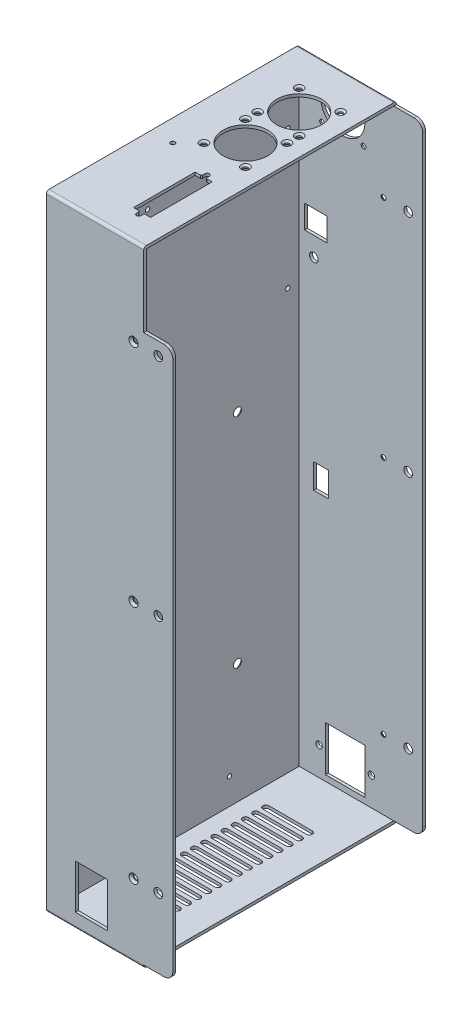
from build123d import *

# Parameters (mm, degrees)
SKETCH1_W                                         = 174
SKETCH1_H                                         = 430
BOSS_EXTRUDE1_DEPTH                               = 2
SKETCH2_W                                         = 174
SKETCH2_H                                         = 430
SKETCH2_W_2                                       = 170
SKETCH2_H_2                                       = 426
BOSS_EXTRUDE2_DEPTH                               = 65
SKETCH3_W                                         = 2
SKETCH3_H                                         = 377
SKETCH3_H_2                                       = 426
BOSS_EXTRUDE3_DEPTH                               = 20
FILLET1_R                                         = 1.8
SKETCH4_W                                         = 22.15
SKETCH4_H                                         = 30.5
CUT_EXTRUDE1_DEPTH                                = 5
SKETCH5_R                                         = 2.25
SKETCH5_R_2                                       = 3
SKETCH5_R_3                                       = 15.187
SKETCH5_R_4                                       = 1
SKETCH5_W                                         = 27.3
SKETCH5_H                                         = 31.1
SKETCH5_W_2                                       = 15.303
SKETCH5_H_2                                       = 16
SKETCH5_W_3                                       = 10
SKETCH5_H_3                                       = 17
CUT_EXTRUDE2_DEPTH                                = 5
SKETCH6_R                                         = 15.367
SKETCH6_R_2                                       = 1
SKETCH6_R_3                                       = 1.5
CUT_EXTRUDE3_DEPTH                                = 5
CSK_FOR_4_FLAT_HEAD_MACHINE_SCREW_100_D           = 3.2639
CSK_FOR_4_FLAT_HEAD_MACHINE_SCREW_100_DEPTH       = 10
CSK_FOR_4_FLAT_HEAD_MACHINE_SCREW_100_CSINK_D     = 5.715
CSK_FOR_4_FLAT_HEAD_MACHINE_SCREW_100_CSINK_ANGLE = 100
CSK_FOR_4_FLAT_HEAD_MACHINE_SCREW_100_TIP         = 0.980574487
CSK_FOR_4_FLAT_HEAD_MACHINE_SCREW_2_D             = 3.2639
CSK_FOR_4_FLAT_HEAD_MACHINE_SCREW_2_DEPTH         = 10
CSK_FOR_4_FLAT_HEAD_MACHINE_SCREW_2_CSINK_D       = 5.715
CSK_FOR_4_FLAT_HEAD_MACHINE_SCREW_2_CSINK_ANGLE   = 100
CSK_FOR_4_FLAT_HEAD_MACHINE_SCREW_2_TIP           = 0.980574487
SKETCH11_R                                        = 1.5
CUT_EXTRUDE4_DEPTH                                = 5
CSK_FOR_M4_FLAT_HEAD_MACHINE_SCREW1_D             = 4.5
CSK_FOR_M4_FLAT_HEAD_MACHINE_SCREW1_DEPTH         = 10
CSK_FOR_M4_FLAT_HEAD_MACHINE_SCREW1_CSINK_D       = 9.4
CSK_FOR_M4_FLAT_HEAD_MACHINE_SCREW1_CSINK_ANGLE   = 90
CSK_FOR_M4_FLAT_HEAD_MACHINE_SCREW1_TIP           = 1.351936393
SKETCH14_R                                        = 1.5
SKETCH14_R_2                                      = 3
CUT_EXTRUDE5_DEPTH                                = 290.948271249
CSK_FOR_M3_FLAT_HEAD_MACHINE_SCREW1_D             = 3.4
CSK_FOR_M3_FLAT_HEAD_MACHINE_SCREW1_DEPTH         = 10
CSK_FOR_M3_FLAT_HEAD_MACHINE_SCREW1_CSINK_D       = 6.3
CSK_FOR_M3_FLAT_HEAD_MACHINE_SCREW1_CSINK_ANGLE   = 90
CSK_FOR_M3_FLAT_HEAD_MACHINE_SCREW1_TIP           = 1.021463052
CSK_FOR_M3_FLAT_HEAD_MACHINE_SCREW2_D             = 3.4
CSK_FOR_M3_FLAT_HEAD_MACHINE_SCREW2_CSINK_D       = 6.3
CSK_FOR_M3_FLAT_HEAD_MACHINE_SCREW2_CSINK_ANGLE   = 90
CUT_EXTRUDE6_DEPTH                                = 10
FILLET2_R                                         = 6


with BuildPart() as part:
    # Sketch1 → Boss-Extrude1 (new body)
    with BuildSketch(Plane(origin=(0, 0, 0), x_dir=(0, 0, -1), z_dir=(1, 0, 0))):
        Rectangle(SKETCH1_W, SKETCH1_H)
    extrude(amount=BOSS_EXTRUDE1_DEPTH)

    # Sketch2 → Boss-Extrude2 (add)
    with BuildSketch(Plane(origin=(2, 0, 0), x_dir=(0, 0, -1), z_dir=(1, 0, 0))):
        Rectangle(SKETCH2_W, SKETCH2_H)
        Rectangle(SKETCH2_W_2, SKETCH2_H_2, mode=Mode.SUBTRACT)
    extrude(amount=BOSS_EXTRUDE2_DEPTH)

    # Sketch3 → Boss-Extrude3 (add)
    with BuildSketch(Plane(origin=(67, 0, 0), x_dir=(0, 0, -1), z_dir=(1, 0, 0))):
        with Locations((-86, -24.5)):
            Rectangle(SKETCH3_W, SKETCH3_H)
        with Locations((86, 0)):
            Rectangle(SKETCH3_W, SKETCH3_H_2)
    extrude(amount=BOSS_EXTRUDE3_DEPTH)

    # Fillet1
    fillet1_edges = [part.edges().sort_by_distance(p)[0] for p in [
        (33.5, -215, -87),
        (33.5, -215, 87),
        (33.5, 215, -87),
        (33.5, 215, 87),
    ]]
    fillet(fillet1_edges, radius=FILLET1_R)

    # Sketch4 → Cut-Extrude1 (cut)
    with BuildSketch(Plane.XY.offset(87)):
        with Locations((31.075, -189.75)):
            Rectangle(SKETCH4_W, SKETCH4_H)
    extrude(amount=-CUT_EXTRUDE1_DEPTH, mode=Mode.SUBTRACT)

    # Sketch5 → Cut-Extrude2 (cut)
    with BuildSketch(Plane(origin=(0, 0, -87), x_dir=(-1, 0, 0), z_dir=(0, 0, -1))):
        with Locations(Location((-51.65, -193.45, 0), (0, 0, 90))):
            Circle(SKETCH5_R)
        with Locations(Location((-15.65, -193.45, 0), (0, 0, 90))):
            Circle(SKETCH5_R)
        with Locations(Location((-12.096, 95.3, 0), (0, 0, 90))):
            Circle(SKETCH5_R_2)
        with Locations(Location((-32, 193, 0), (0, 0, 90))):
            Circle(SKETCH5_R_3)
        with Locations(Location((-46.2875, 207.2875, 0), (0, 0, 90))):
            Circle(SKETCH5_R_4)
        with Locations(Location((-17.7125, 207.2875, 0), (0, 0, 90))):
            Circle(SKETCH5_R_4)
        with Locations(Location((-46.2875, 178.7125, 0), (0, 0, 90))):
            Circle(SKETCH5_R_4)
        with Locations(Location((-17.7125, 178.7125, 0), (0, 0, 90))):
            Circle(SKETCH5_R_4)
        with Locations((-33.65, -193.45)):
            Rectangle(SKETCH5_W, SKETCH5_H)
        with Locations((-13.4295, 116.48)):
            Rectangle(SKETCH5_W_2, SKETCH5_H_2)
        with Locations((-17, -35)):
            Rectangle(SKETCH5_W_3, SKETCH5_H_3)
    extrude(amount=-CUT_EXTRUDE2_DEPTH, mode=Mode.SUBTRACT)

    # Sketch6 → Cut-Extrude3 (cut)
    with BuildSketch(Plane(origin=(0, 215, 0), x_dir=(1, 0, 0), z_dir=(0, 1, 0))):
        with Locations(Location((40, 47, 0), (0, 0, 270))):
            Circle(SKETCH6_R)
        with Locations(Location((40, 10, 0), (0, 0, 270))):
            Circle(SKETCH6_R)
        with Locations(Location((25.7125, 61.2875, 0), (0, 0, 270))):
            Circle(SKETCH6_R_2)
        with Locations(Location((25.7125, 32.7125, 0), (0, 0, 270))):
            Circle(SKETCH6_R_2)
        with Locations(Location((25.7125, 24.2875, 0), (0, 0, 270))):
            Circle(SKETCH6_R_2)
        with Locations(Location((25.7125, -4.2875, 0), (0, 0, 270))):
            Circle(SKETCH6_R_2)
        with Locations(Location((54.2875, -4.2875, 0), (0, 0, 270))):
            Circle(SKETCH6_R_2)
        with Locations(Location((54.2875, 24.2875, 0), (0, 0, 270))):
            Circle(SKETCH6_R_2)
        with Locations(Location((54.2875, 32.7125, 0), (0, 0, 270))):
            Circle(SKETCH6_R_2)
        with Locations(Location((54.2875, 61.2875, 0), (0, 0, 270))):
            Circle(SKETCH6_R_2)
        with Locations(Location((15, -15, 0), (0, 0, 270))):
            Circle(SKETCH6_R_3)
        with BuildLine():
            Line((40, -24.6), (43.528, -24.6))
            ThreePointArc((43.528, -24.6), (44.102877813, -24.361877813), (44.341, -23.787))
            Line((44.341, -23.787), (44.341, -22.3))
            ThreePointArc((44.341, -22.3), (45.865, -20.776), (47.389, -22.3))
            Line((47.389, -22.3), (47.389, -23.787))
            ThreePointArc((47.389, -23.787), (47.627122187, -24.361877813), (48.202, -24.6))
            Line((48.202, -24.6), (51.73, -24.6))
            Line((51.73, -24.6), (51.73, -67))
            Line((51.73, -67), (48.202, -67))
            ThreePointArc((48.202, -67), (47.627122187, -67.238122187), (47.389, -67.813))
            Line((47.389, -67.813), (47.389, -69.3))
            ThreePointArc((47.389, -69.3), (45.865, -70.824), (44.341, -69.3))
            Line((44.341, -69.3), (44.341, -67.813))
            ThreePointArc((44.341, -67.813), (44.102877813, -67.238122187), (43.528, -67))
            Line((43.528, -67), (40, -67))
            Line((40, -67), (40, -24.6))
        make_face()
    extrude(amount=-CUT_EXTRUDE3_DEPTH, mode=Mode.SUBTRACT)

    # CSK for _4 Flat Head Machine Screw _100
    with Locations(Plane(origin=(0, 215, 0), x_dir=(-1, 0, 0), z_dir=(0, 1, 0))):
        with Locations((-25.7125, 4.2875), (-25.7125, -61.2875), (-54.2875, -61.2875), (-54.2875, -32.7125), (-25.7125, -32.7125), (-25.7125, -24.2875), (-54.2875, -24.2875), (-54.2875, 4.2875)):
            CounterSinkHole(CSK_FOR_4_FLAT_HEAD_MACHINE_SCREW_100_D / 2, CSK_FOR_4_FLAT_HEAD_MACHINE_SCREW_100_CSINK_D / 2, depth=CSK_FOR_4_FLAT_HEAD_MACHINE_SCREW_100_DEPTH, counter_sink_angle=CSK_FOR_4_FLAT_HEAD_MACHINE_SCREW_100_CSINK_ANGLE)
            with Locations((0, 0, -(CSK_FOR_4_FLAT_HEAD_MACHINE_SCREW_100_DEPTH + CSK_FOR_4_FLAT_HEAD_MACHINE_SCREW_100_TIP / 2))):  # 118° drill point
                Cone(0, CSK_FOR_4_FLAT_HEAD_MACHINE_SCREW_100_D / 2, CSK_FOR_4_FLAT_HEAD_MACHINE_SCREW_100_TIP, mode=Mode.SUBTRACT)

    # CSK for _4 Flat Head Machine Screw _ 2
    with Locations(Plane(origin=(0, 0, -87), x_dir=(-1, 0, 0), z_dir=(0, 0, -1))):
        with Locations((-46.2875, 207.2875), (-17.7125, 207.2875), (-17.7125, 178.7125), (-46.2875, 178.7125)):
            CounterSinkHole(CSK_FOR_4_FLAT_HEAD_MACHINE_SCREW_2_D / 2, CSK_FOR_4_FLAT_HEAD_MACHINE_SCREW_2_CSINK_D / 2, depth=CSK_FOR_4_FLAT_HEAD_MACHINE_SCREW_2_DEPTH, counter_sink_angle=CSK_FOR_4_FLAT_HEAD_MACHINE_SCREW_2_CSINK_ANGLE)
            with Locations((0, 0, -(CSK_FOR_4_FLAT_HEAD_MACHINE_SCREW_2_DEPTH + CSK_FOR_4_FLAT_HEAD_MACHINE_SCREW_2_TIP / 2))):  # 118° drill point
                Cone(0, CSK_FOR_4_FLAT_HEAD_MACHINE_SCREW_2_D / 2, CSK_FOR_4_FLAT_HEAD_MACHINE_SCREW_2_TIP, mode=Mode.SUBTRACT)

    # Sketch11 → Cut-Extrude4 (cut)
    with BuildSketch(Plane(origin=(2, 0, 0), x_dir=(0, 0, -1), z_dir=(1, 0, 0))):
        with Locations((-19.33, 171.06)):
            Circle(SKETCH11_R)
        with Locations((77.19, 171.06)):
            Circle(SKETCH11_R)
        with Locations((-19.33, 75.81)):
            Circle(SKETCH11_R)
        with Locations((77.19, 75.81)):
            Circle(SKETCH11_R)
        with Locations((-7.5, 19.5)):
            Circle(SKETCH11_R)
        with Locations((42.5, 19.5)):
            Circle(SKETCH11_R)
        with Locations((42.5, -130.5)):
            Circle(SKETCH11_R)
        with Locations((-7.5, -130.5)):
            Circle(SKETCH11_R)
        with Locations((37, -195)):
            Circle(SKETCH11_R)
    extrude(amount=-CUT_EXTRUDE4_DEPTH, mode=Mode.SUBTRACT)

    # CSK for M4 Flat Head Machine Screw1
    with Locations(Plane.ZY):
        with Locations((-42.5, 19.5), (7.5, 19.5), (7.5, -130.5), (-42.5, -130.5)):
            CounterSinkHole(CSK_FOR_M4_FLAT_HEAD_MACHINE_SCREW1_D / 2, CSK_FOR_M4_FLAT_HEAD_MACHINE_SCREW1_CSINK_D / 2, depth=CSK_FOR_M4_FLAT_HEAD_MACHINE_SCREW1_DEPTH, counter_sink_angle=CSK_FOR_M4_FLAT_HEAD_MACHINE_SCREW1_CSINK_ANGLE)
            with Locations((0, 0, -(CSK_FOR_M4_FLAT_HEAD_MACHINE_SCREW1_DEPTH + CSK_FOR_M4_FLAT_HEAD_MACHINE_SCREW1_TIP / 2))):  # 118° drill point
                Cone(0, CSK_FOR_M4_FLAT_HEAD_MACHINE_SCREW1_D / 2, CSK_FOR_M4_FLAT_HEAD_MACHINE_SCREW1_TIP, mode=Mode.SUBTRACT)

    # Sketch14 → Cut-Extrude5 (cut, through all)
    with BuildSketch(Plane.XY.offset(87)):
        with Locations((60, 155)):
            Circle(SKETCH14_R)
        with Locations((60, 0)):
            Circle(SKETCH14_R)
        with Locations((60, -165)):
            Circle(SKETCH14_R)
        with Locations((77, 155)):
            Circle(SKETCH14_R_2)
        with Locations((77, 0)):
            Circle(SKETCH14_R_2)
        with Locations((77, -165)):
            Circle(SKETCH14_R_2)
    extrude(amount=-CUT_EXTRUDE5_DEPTH, mode=Mode.SUBTRACT)

    # CSK for M3 Flat Head Machine Screw1
    with Locations(Plane(origin=(0, 0, -87), x_dir=(-1, 0, 0), z_dir=(0, 0, -1))):
        with Locations((-60, 155), (-60, 0), (-60, -165)):
            CounterSinkHole(CSK_FOR_M3_FLAT_HEAD_MACHINE_SCREW1_D / 2, CSK_FOR_M3_FLAT_HEAD_MACHINE_SCREW1_CSINK_D / 2, depth=CSK_FOR_M3_FLAT_HEAD_MACHINE_SCREW1_DEPTH, counter_sink_angle=CSK_FOR_M3_FLAT_HEAD_MACHINE_SCREW1_CSINK_ANGLE)
            with Locations((0, 0, -(CSK_FOR_M3_FLAT_HEAD_MACHINE_SCREW1_DEPTH + CSK_FOR_M3_FLAT_HEAD_MACHINE_SCREW1_TIP / 2))):  # 118° drill point
                Cone(0, CSK_FOR_M3_FLAT_HEAD_MACHINE_SCREW1_D / 2, CSK_FOR_M3_FLAT_HEAD_MACHINE_SCREW1_TIP, mode=Mode.SUBTRACT)

    # CSK for M3 Flat Head Machine Screw2 (through all)
    with Locations(Plane.XY.offset(87)):
        with Locations((60, 155), (60, 0), (60, -165)):
            CounterSinkHole(CSK_FOR_M3_FLAT_HEAD_MACHINE_SCREW2_D / 2, CSK_FOR_M3_FLAT_HEAD_MACHINE_SCREW2_CSINK_D / 2, counter_sink_angle=CSK_FOR_M3_FLAT_HEAD_MACHINE_SCREW2_CSINK_ANGLE)

    # Sketch20 → Cut-Extrude6 (cut)
    with BuildSketch(Plane.XZ.offset(215)):
        with BuildLine():
            Line((15, 37), (45, 37))
            ThreePointArc((45, 37), (47, 35), (45, 33))
            Line((45, 33), (15, 33))
            ThreePointArc((15, 33), (13, 35), (15, 37))
        make_face()
        with BuildLine():
            Line((15, 30), (45, 30))
            ThreePointArc((45, 30), (47, 28), (45, 26))
            Line((45, 26), (15, 26))
            ThreePointArc((15, 26), (13, 28), (15, 30))
        make_face()
        with BuildLine():
            Line((15, 23), (45, 23))
            ThreePointArc((45, 23), (47, 21), (45, 19))
            Line((45, 19), (15, 19))
            ThreePointArc((15, 19), (13, 21), (15, 23))
        make_face()
        with BuildLine():
            Line((15, 16), (45, 16))
            ThreePointArc((45, 16), (47, 14), (45, 12))
            Line((45, 12), (15, 12))
            ThreePointArc((15, 12), (13, 14), (15, 16))
        make_face()
        with BuildLine():
            Line((15, 9), (45, 9))
            ThreePointArc((45, 9), (47, 7), (45, 5))
            Line((45, 5), (15, 5))
            ThreePointArc((15, 5), (13, 7), (15, 9))
        make_face()
        with BuildLine():
            Line((15, 2), (45, 2))
            ThreePointArc((45, 2), (47, 0), (45, -2))
            Line((45, -2), (15, -2))
            ThreePointArc((15, -2), (13, 0), (15, 2))
        make_face()
        with BuildLine():
            Line((15, -5), (45, -5))
            ThreePointArc((45, -5), (47, -7), (45, -9))
            Line((45, -9), (15, -9))
            ThreePointArc((15, -9), (13, -7), (15, -5))
        make_face()
        with BuildLine():
            Line((15, -12), (45, -12))
            ThreePointArc((45, -12), (47, -14), (45, -16))
            Line((45, -16), (15, -16))
            ThreePointArc((15, -16), (13, -14), (15, -12))
        make_face()
        with BuildLine():
            Line((15, -19), (45, -19))
            ThreePointArc((45, -19), (47, -21), (45, -23))
            Line((45, -23), (15, -23))
            ThreePointArc((15, -23), (13, -21), (15, -19))
        make_face()
        with BuildLine():
            Line((15, -26), (45, -26))
            ThreePointArc((45, -26), (47, -28), (45, -30))
            Line((45, -30), (15, -30))
            ThreePointArc((15, -30), (13, -28), (15, -26))
        make_face()
        with BuildLine():
            Line((15, -33), (45, -33))
            ThreePointArc((45, -33), (47, -35), (45, -37))
            Line((45, -37), (15, -37))
            ThreePointArc((15, -37), (13, -35), (15, -33))
        make_face()
        with BuildLine():
            Line((15, 44), (45, 44))
            ThreePointArc((45, 44), (47, 42), (45, 40))
            Line((45, 40), (15, 40))
            ThreePointArc((15, 40), (13, 42), (15, 44))
        make_face()
        with BuildLine():
            Line((15, 51), (45, 51))
            ThreePointArc((45, 51), (47, 49), (45, 47))
            Line((45, 47), (15, 47))
            ThreePointArc((15, 47), (13, 49), (15, 51))
        make_face()
        with BuildLine():
            Line((15, -40), (45, -40))
            ThreePointArc((45, -40), (47, -42), (45, -44))
            Line((45, -44), (15, -44))
            ThreePointArc((15, -44), (13, -42), (15, -40))
        make_face()
        with BuildLine():
            Line((15, -47), (45, -47))
            ThreePointArc((45, -47), (47, -49), (45, -51))
            Line((45, -51), (15, -51))
            ThreePointArc((15, -51), (13, -49), (15, -47))
        make_face()
    extrude(amount=-CUT_EXTRUDE6_DEPTH, mode=Mode.SUBTRACT)

    # Fillet2
    fillet2_edges = [part.edges().sort_by_distance(p)[0] for p in [
        (87, 164, 86),
        (87, 213, -86),
        (87, -213, -86),
        (87, -213, 86),
    ]]
    fillet(fillet2_edges, radius=FILLET2_R)


solid = part.part
